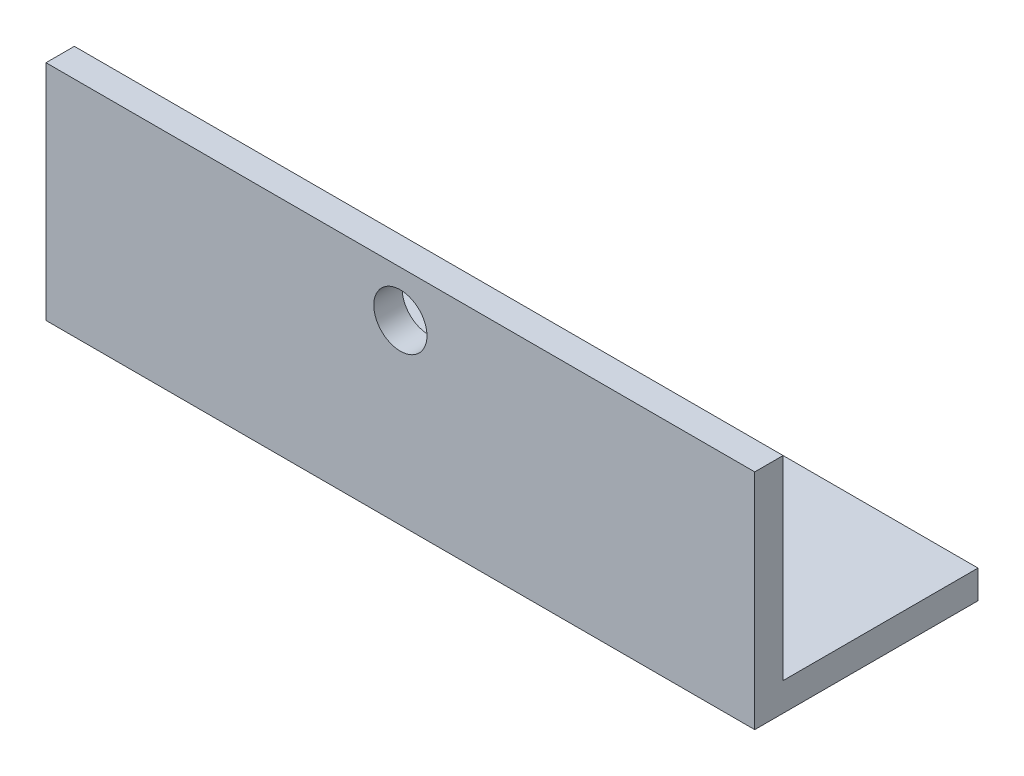
from build123d import *

# Parameters (mm, degrees)
BOSS_EXTRUDE1_DEPTH = 1.6
SKETCH3_W           = 40
SKETCH3_H           = 1.6
BOSS_EXTRUDE3_DEPTH = 11
SKETCH4_R           = 1.5
CUT_EXTRUDE2_DEPTH  = 27.786563796


with BuildPart() as part:
    # Sketch1 → Boss-Extrude1 (new body)
    with BuildSketch(Plane(origin=(0, 0, 0), x_dir=(1, 0, 0), z_dir=(0, 1, 0))):
        with BuildLine():
            Line((0, 0), (0, 6.3))
            Line((0, 6.3), (-11, 6.3))
            ThreePointArc((-11, 6.3), (-12.5, 4.8), (-14, 6.3))
            Line((-14, 6.3), (-20, 6.3))
            Line((-20, 6.3), (-20, 0))
            Line((-20, 0), (0, 0))
        make_face()
        with BuildLine():
            Line((20, 6.3), (14, 6.3))
            ThreePointArc((14, 6.3), (12.5, 4.8), (11, 6.3))
            Line((11, 6.3), (0, 6.3))
            Line((0, 6.3), (0, 0))
            Line((0, 0), (20, 0))
            Line((20, 0), (20, 6.3))
        make_face()
        with BuildLine():
            ThreePointArc((11, 6.3), (12.5, 7.8), (14, 6.3))
            Line((14, 6.3), (20, 6.3))
            Line((20, 6.3), (20, 12.6))
            Line((20, 12.6), (0, 12.6))
            Line((0, 12.6), (0, 6.3))
            Line((0, 6.3), (11, 6.3))
        make_face()
        with BuildLine():
            Line((-11, 6.3), (0, 6.3))
            Line((0, 6.3), (0, 12.6))
            Line((0, 12.6), (-20, 12.6))
            Line((-20, 12.6), (-20, 6.3))
            Line((-20, 6.3), (-14, 6.3))
            ThreePointArc((-14, 6.3), (-12.5, 7.8), (-11, 6.3))
        make_face()
    extrude(amount=BOSS_EXTRUDE1_DEPTH)

    # Sketch3 → Boss-Extrude3 (add)
    with BuildSketch(Plane(origin=(0, 1.6, 0), x_dir=(1, 0, 0), z_dir=(0, 1, 0))):
        with Locations((0, 0.8)):
            Rectangle(SKETCH3_W, SKETCH3_H)
    extrude(amount=BOSS_EXTRUDE3_DEPTH)

    # Sketch4 → Cut-Extrude2 (cut, through all)
    with BuildSketch(Plane.XY):
        with Locations((0, 10)):
            Circle(SKETCH4_R)
    extrude(amount=-CUT_EXTRUDE2_DEPTH, mode=Mode.SUBTRACT)


solid = part.part
